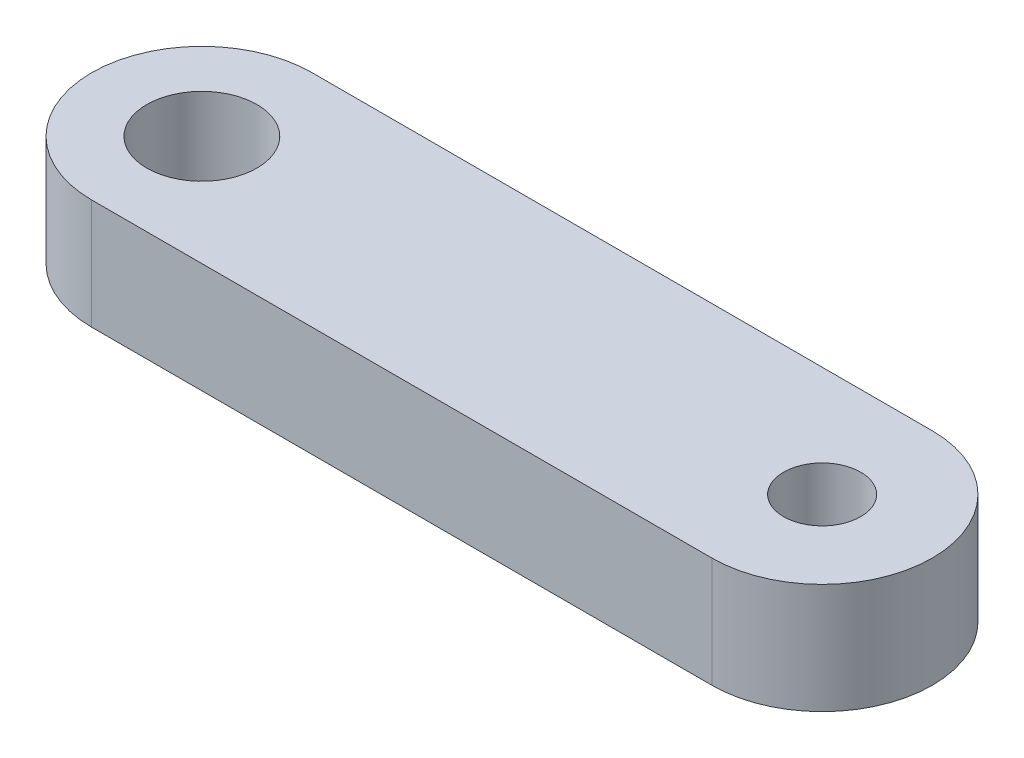
from build123d import *

# Parameters (mm, degrees)
DODANIE_WYCI_GNI_CIE2_DEPTH = 5
SZKIC2_R                    = 2.5
SZKIC2_R_2                  = 1.75
WYTNIJ_WYCI_GNI_CIE1_DEPTH  = 5


with BuildPart() as part:
    # Szkic1 → Dodanie-wyciągnięcie2 (new body)
    with BuildSketch(Plane(origin=(0, 0, 0), x_dir=(1, 0, 0), z_dir=(0, 1, 0))):
        with BuildLine():
            Line((-14.07, 0), (14.07, 0))
            ThreePointArc((14.07, 0), (19.07, 5), (14.07, 10))
            Line((14.07, 10), (-14.07, 10))
            ThreePointArc((-14.07, 10), (-19.07, 5), (-14.07, 0))
        make_face()
    extrude(amount=DODANIE_WYCI_GNI_CIE2_DEPTH)

    # Szkic2 → Wytnij-wyciągnięcie1 (cut)
    with BuildSketch(Plane(origin=(0, 5, 0), x_dir=(1, 0, 0), z_dir=(0, 1, 0))):
        with Locations(Location((-14.07, 5, 0), (0, 0, 270))):
            Circle(SZKIC2_R)
        with Locations(Location((14.07, 5, 0), (0, 0, 270))):
            Circle(SZKIC2_R_2)
    extrude(amount=-WYTNIJ_WYCI_GNI_CIE1_DEPTH, mode=Mode.SUBTRACT)


solid = part.part
